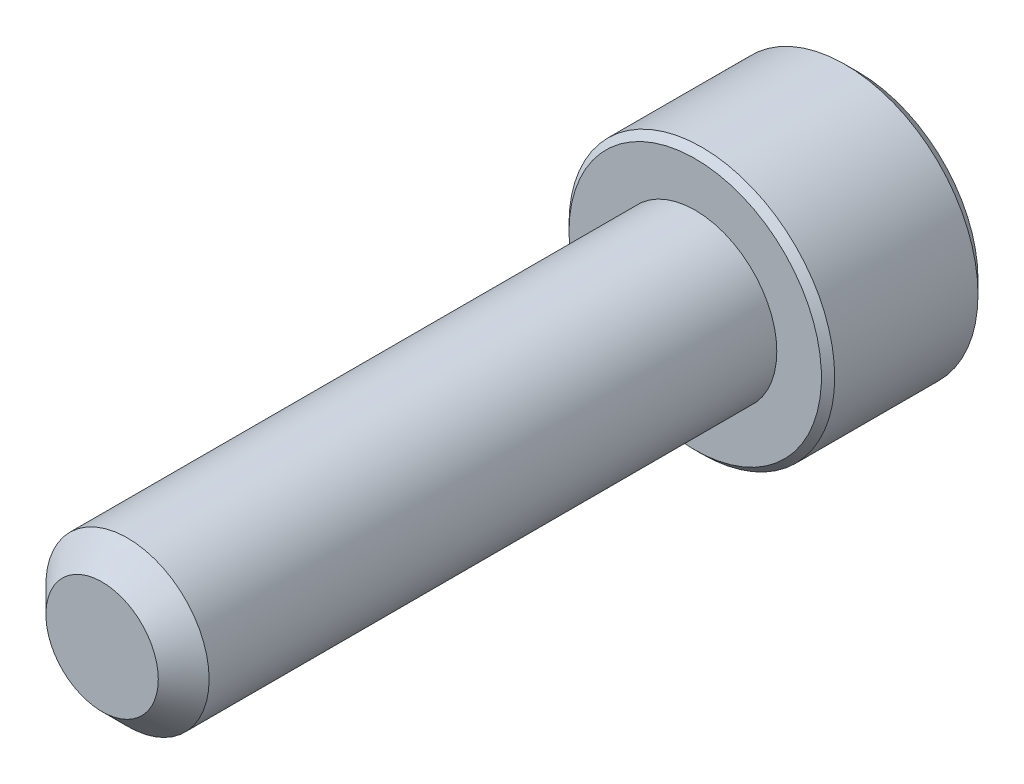
from build123d import *

# Parameters (mm, degrees)
SKETCH1_R          = 1.0922
EXTRUDE1_DEPTH     = 7.9375
CHAMFER3_SIZE      = 0.340178571
SKETCH6_R          = 1.778
EXTRUDE2_DEPTH     = 2.1844
CUT_EXTRUDE1_DEPTH = 1.48828125
CHAMFER1_SIZE      = 0.1778
CHAMFER2_SIZE      = 0.0889


with BuildPart() as part:
    # Sketch1 → Extrude1 (new body)
    with BuildSketch(Plane.XY):
        Circle(SKETCH1_R)
    extrude(amount=-EXTRUDE1_DEPTH)

    # Chamfer3
    chamfer3_edges = [part.edges().sort_by_distance(p)[0] for p in [
        (-1.0922, 0, 0),
    ]]
    chamfer(chamfer3_edges, length=CHAMFER3_SIZE)

    # Sketch6 → Extrude2 (add)
    with BuildSketch(Plane(origin=(0, 0, -7.9375), x_dir=(-1, 0, 0), z_dir=(0, 0, -1))):
        Circle(SKETCH6_R)
    extrude(amount=EXTRUDE2_DEPTH)

    # Sketch7 → Cut-Extrude1 (cut)
    with BuildSketch(Plane(origin=(0, 0, -10.1219), x_dir=(-1, 0, 0), z_dir=(0, 0, -1))):
        Polygon((0, 1.14567944), (-0.9921875, 0.57283972), (-0.9921875, -0.57283972), (0, -1.14567944), (0.9921875, -0.57283972), (0.9921875, 0.57283972), align=None)
    extrude(amount=-CUT_EXTRUDE1_DEPTH, mode=Mode.SUBTRACT)

    # Cut-Extrude2 cone 1 section (through the dimple's axis) → Cut-Extrude2 (revolve, cut)
    with BuildSketch(Plane(origin=(0, 0, -10.1219), x_dir=(0, 1, 0), z_dir=(1, 0, 0))):
        Polygon((0, 0), (1.14567944, 0), (0, 1.14567944), align=None)
    revolve(axis=Axis((0, 0, -10.1219), (0, 0, 1)), mode=Mode.SUBTRACT)

    # Chamfer1
    chamfer1_edges = [part.edges().sort_by_distance(p)[0] for p in [
        (1.778, 0, -10.1219),
    ]]
    chamfer(chamfer1_edges, length=CHAMFER1_SIZE)

    # Chamfer2
    chamfer2_edges = [part.edges().sort_by_distance(p)[0] for p in [
        (1.778, 0, -7.9375),
    ]]
    chamfer(chamfer2_edges, length=CHAMFER2_SIZE)


solid = part.part
